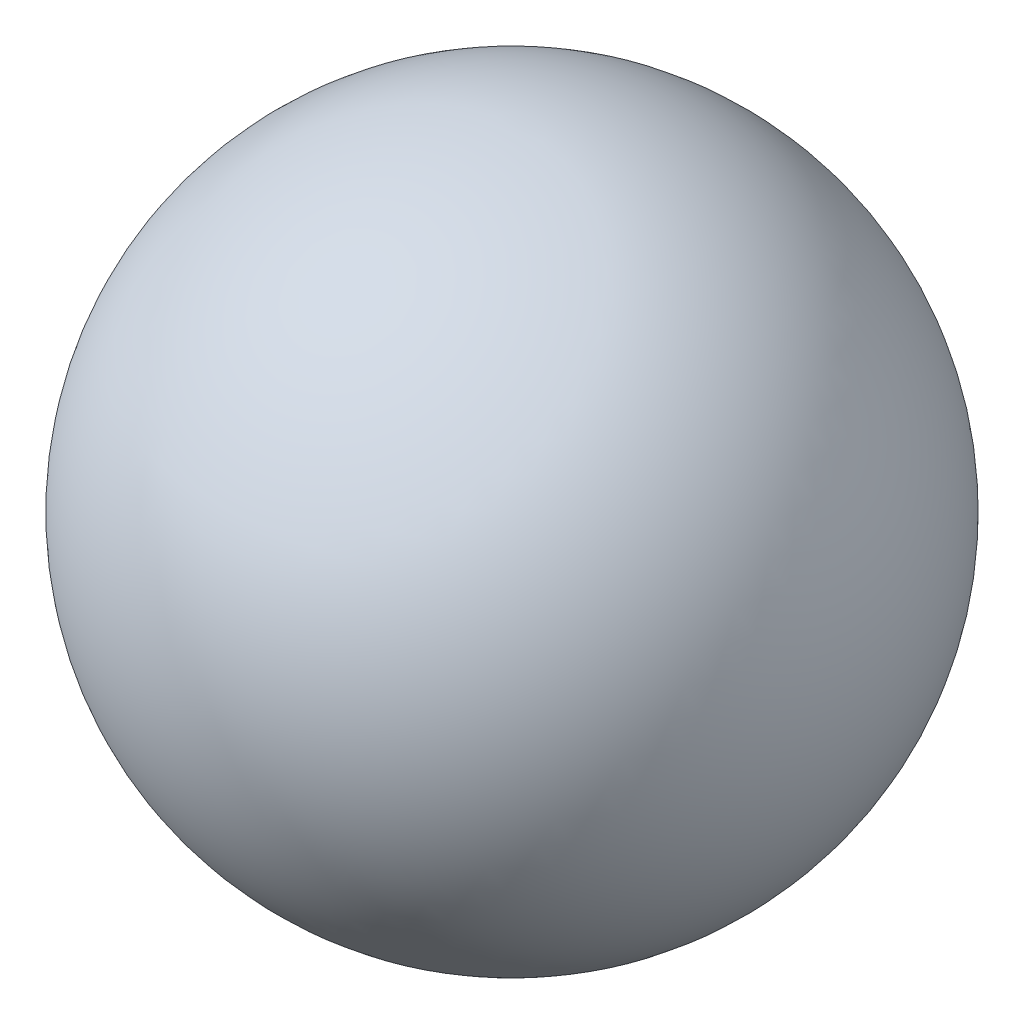
from build123d import *


with BuildPart() as part:
    # 草图1 one side → 旋转1 (revolve)
    with BuildSketch(Plane.XY):
        with BuildLine():
            Line((0, -75), (0, 75))
            ThreePointArc((0, 75), (-75, 0), (0, -75))
        make_face()
    revolve(axis=Axis((0, 0, 0), (0, 1, 0)))


solid = part.part
